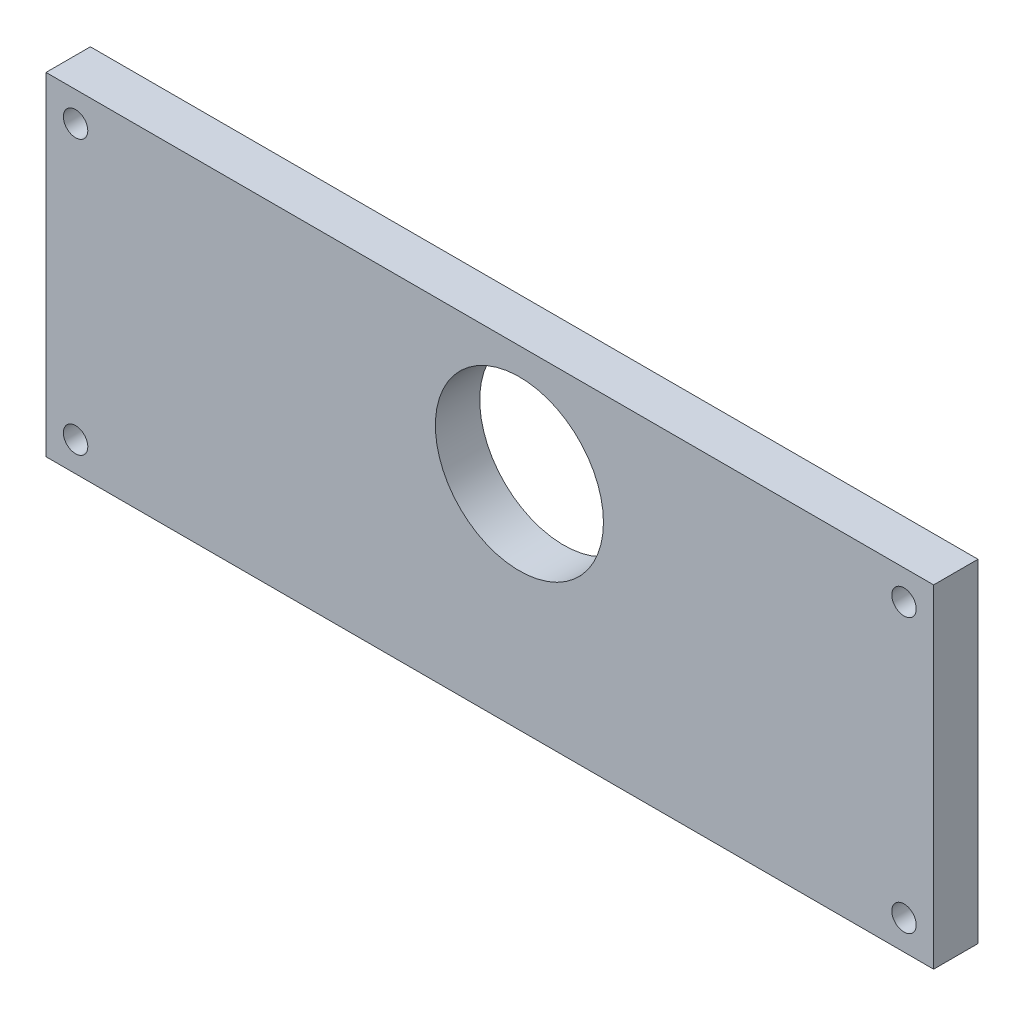
from build123d import *

# Parameters (mm, degrees)
SKETCH1_W           = 120
SKETCH1_H           = 45
SKETCH1_R           = 11.3625
SKETCH1_R_2         = 1.65
BOSS_EXTRUDE1_DEPTH = 6
CUT_EXTRUDE1_START  = -6
SKETCH2_R           = 3
SKETCH2_R_2         = 1.65
CUT_EXTRUDE1_DEPTH  = 3


with BuildPart() as part:
    # Sketch1 → Boss-Extrude1 (new body)
    with BuildSketch(Plane.XY):
        with Locations((60, 22.5)):
            Rectangle(SKETCH1_W, SKETCH1_H)
        with Locations((64, 30)):
            Circle(SKETCH1_R, mode=Mode.SUBTRACT)
        with Locations((4, 41)):
            Circle(SKETCH1_R_2, mode=Mode.SUBTRACT)
        with Locations(Location((4, 4, 0), (0, 0, 180))):
            Circle(SKETCH1_R_2, mode=Mode.SUBTRACT)
        with Locations(Location((116, 41, 0), (0, 0, 180))):
            Circle(SKETCH1_R_2, mode=Mode.SUBTRACT)
        with Locations((116, 4)):
            Circle(SKETCH1_R_2, mode=Mode.SUBTRACT)
    extrude(amount=BOSS_EXTRUDE1_DEPTH)

    # Sketch2 → Cut-Extrude1 (cut)
    # profile 1 of 4: a face of its own
    with BuildSketch(Plane.XY.offset(6).offset(CUT_EXTRUDE1_START)):
        with Locations(Location((4, 41, 0), (0, 0, 180))):
            Circle(SKETCH2_R)
        with Locations(Location((4, 41, 0), (0, 0, 180))):
            Circle(SKETCH2_R_2, mode=Mode.SUBTRACT)
    # profile 2 of 4: a face of its own
    with BuildSketch(Plane.XY.offset(6).offset(CUT_EXTRUDE1_START)):
        with Locations(Location((4, 4, 0), (0, 0, 180))):
            Circle(SKETCH2_R)
        with Locations(Location((4, 4, 0), (0, 0, 180))):
            Circle(SKETCH2_R_2, mode=Mode.SUBTRACT)
    # profile 3 of 4: a face of its own
    with BuildSketch(Plane.XY.offset(6).offset(CUT_EXTRUDE1_START)):
        with Locations(Location((116, 4, 0), (0, 0, 180))):
            Circle(SKETCH2_R)
        with Locations(Location((116, 4, 0), (0, 0, 180))):
            Circle(SKETCH2_R_2, mode=Mode.SUBTRACT)
    # profile 4 of 4: a face of its own
    with BuildSketch(Plane.XY.offset(6).offset(CUT_EXTRUDE1_START)):
        with Locations(Location((116, 41, 0), (0, 0, 180))):
            Circle(SKETCH2_R)
        with Locations(Location((116, 41, 0), (0, 0, 180))):
            Circle(SKETCH2_R_2, mode=Mode.SUBTRACT)
    extrude(amount=CUT_EXTRUDE1_DEPTH, mode=Mode.SUBTRACT)


solid = part.part
